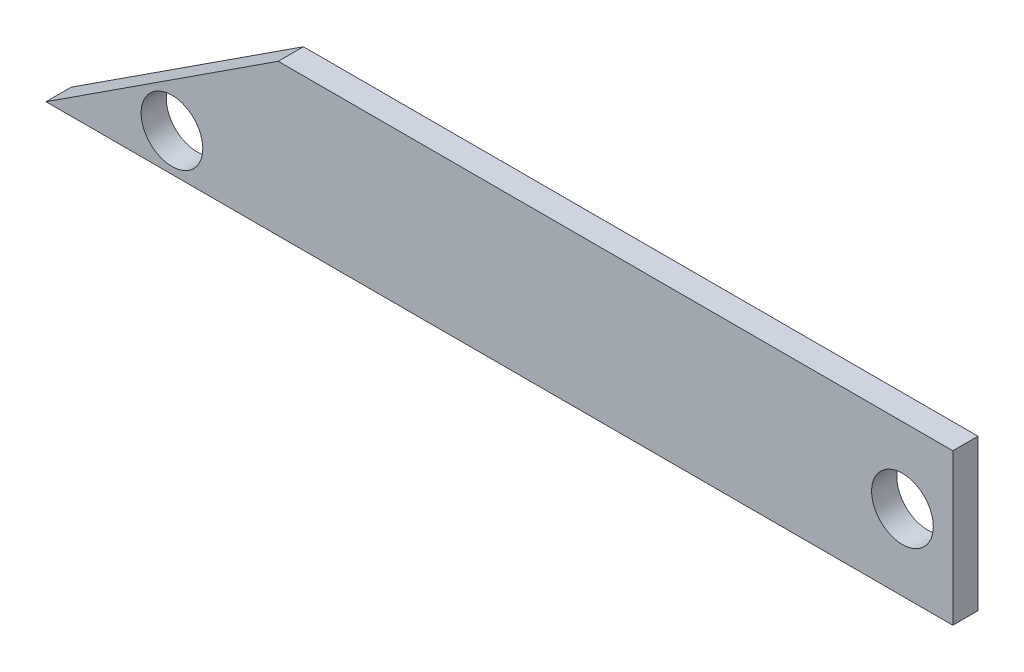
from build123d import *

# Parameters (mm, degrees)
SKETCH1_W           = 457.2
SKETCH1_H           = 76.2
BOSS_EXTRUDE1_DEPTH = 12.7
CUT_EXTRUDE1_DEPTH  = 12.7
SKETCH3_R           = 15.5575
CUT_EXTRUDE2_DEPTH  = 12.7


with BuildPart() as part:
    # Sketch1 → Boss-Extrude1 (new body)
    with BuildSketch(Plane.XY):
        with Locations((228.6, 38.1)):
            Rectangle(SKETCH1_W, SKETCH1_H)
    extrude(amount=BOSS_EXTRUDE1_DEPTH)

    # Sketch2 → Cut-Extrude1 (cut)
    with BuildSketch(Plane.XY.offset(12.7)):
        Polygon((0, 0), (117.088214608, 76.2), (0, 76.2), align=None)
    extrude(amount=-CUT_EXTRUDE1_DEPTH, mode=Mode.SUBTRACT)

    # Sketch3 → Cut-Extrude2 (cut)
    with BuildSketch(Plane.XY.offset(12.7)):
        with Locations((63.5, 19.05)):
            Circle(SKETCH3_R)
        with Locations((431.8, 38.1)):
            Circle(SKETCH3_R)
    extrude(amount=-CUT_EXTRUDE2_DEPTH, mode=Mode.SUBTRACT)


solid = part.part
